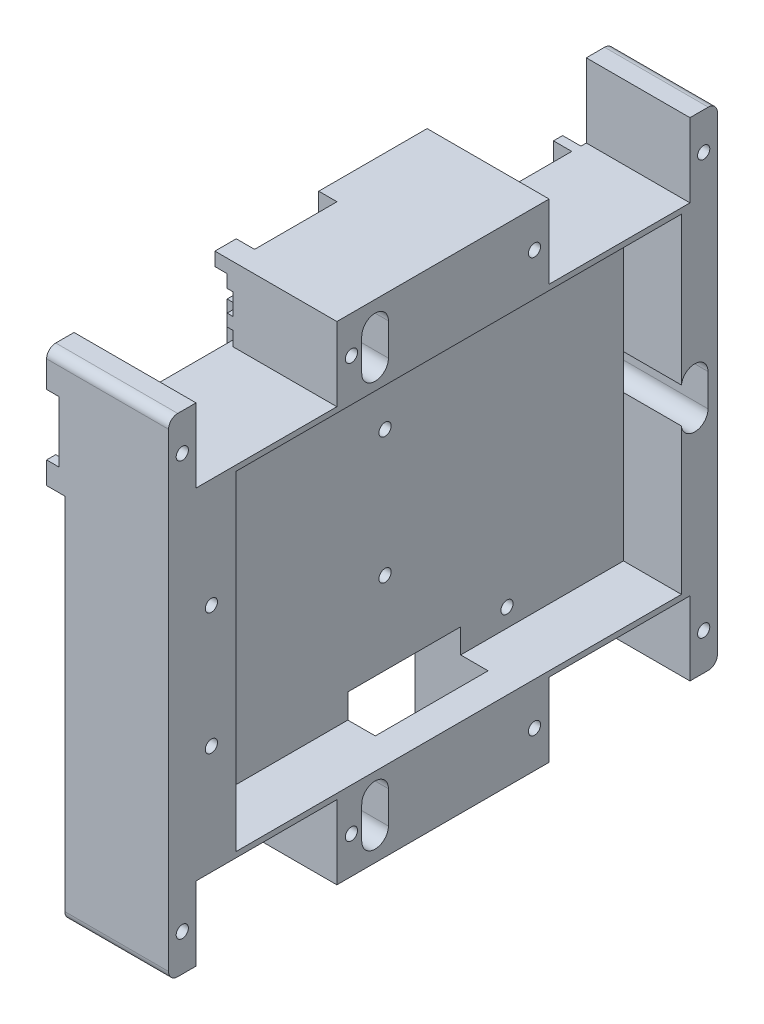
from build123d import *
from build123d.topology import SkipClean

# Parameters (mm, degrees)
SKETCH_1_R          = 1
EXTRUDE_1_DEPTH     = 17
FILLET_1_R          = 1.5
SKETCH_2_W          = 73
SKETCH_2_H          = 54
CUT_EXTRUDE_1_DEPTH = 9.5
CUT_EXTRUDE_2_DEPTH = 63.561969278
SKETCH_5_W          = 1.5
SKETCH_5_H          = 11.7
SKETCH_5_H_2        = 3.65
EXTRUDE_4_DEPTH     = 3
SKETCH_6_W          = 2
SKETCH_6_H          = 2.1
SKETCH_6_W_2        = 28.1
SKETCH_6_H_2        = 2.023191522
SKETCH_6_H_3        = 1.972847365
EXTRUDE_5_DEPTH     = 1
SKETCH_9_W          = 1.5
SKETCH_9_H          = 7.4
EXTRUDE_6_DEPTH     = 3
SKETCH_10_W         = 18.5
SKETCH_10_H         = 17
CUT_EXTRUDE_3_DEPTH = 12


with BuildPart() as part:
    # Эскиз1 → Бобышка-Вытянуть1 (new body)
    with BuildSketch(Plane(origin=(0, 0, 0), x_dir=(0, 0, -1), z_dir=(1, 0, 0))):
        Polygon((0, 40), (-17.4, 40), (-17.4, 27.9), (-40.5, 27.9), (-40.5, 40), (-45, 40), (-45, -40), (-40.5, -40), (-40.5, -27.9), (-17.4, -27.9), (-17.4, -40), (17.4, -40), (17.4, -27.9), (40.5, -27.9), (40.5, -40), (45, -40), (45, 40), (40.5, 40), (40.5, 27.9), (17.4, 27.9), (17.4, 40), align=None)
        with Locations((-42.75, -33.95)):
            Circle(SKETCH_1_R, mode=Mode.SUBTRACT)
        with Locations(Location((-15.009561353, -33.95, 0), (0, 0, 180))):
            Circle(SKETCH_1_R, mode=Mode.SUBTRACT)
        with Locations((15.009561353, -33.95)):
            Circle(SKETCH_1_R, mode=Mode.SUBTRACT)
        with Locations(Location((42.75, -33.95, 0), (0, 0, 180))):
            Circle(SKETCH_1_R, mode=Mode.SUBTRACT)
        with Locations((42.75, 33.95)):
            Circle(SKETCH_1_R, mode=Mode.SUBTRACT)
        with Locations(Location((15.009561353, 33.95, 0), (0, 0, 180))):
            Circle(SKETCH_1_R, mode=Mode.SUBTRACT)
        with Locations((-15.009561353, 33.95)):
            Circle(SKETCH_1_R, mode=Mode.SUBTRACT)
        with Locations(Location((-42.75, 33.95, 0), (0, 0, 180))):
            Circle(SKETCH_1_R, mode=Mode.SUBTRACT)
        with Locations((20, 24)):
            Circle(SKETCH_1_R, mode=Mode.SUBTRACT)
        with Locations((20, -24)):
            Circle(SKETCH_1_R, mode=Mode.SUBTRACT)
        with Locations((-30.9, -9)):
            Circle(SKETCH_1_R, mode=Mode.SUBTRACT)
        with Locations((-30.9, 19)):
            Circle(SKETCH_1_R, mode=Mode.SUBTRACT)
        with Locations((-37.974473267, -10)):
            Circle(SKETCH_1_R, mode=Mode.SUBTRACT)
        with Locations(Location((-37.974473267, 10, 0), (0, 0, 180))):
            Circle(SKETCH_1_R, mode=Mode.SUBTRACT)
        with Locations((0, 11.240266093)):
            Circle(SKETCH_1_R, mode=Mode.SUBTRACT)
        with Locations((0, -9.5)):
            Circle(SKETCH_1_R, mode=Mode.SUBTRACT)
    extrude(amount=EXTRUDE_1_DEPTH)

    # Скругление1
    fillet_1_edges = [part.edges().sort_by_distance(p)[0] for p in [
        (8.5, 40, -45),
        (8.5, -40, -45),
        (8.5, -40, 45),
        (8.5, 40, 45),
    ]]
    fillet(fillet_1_edges, radius=FILLET_1_R)

    # Эскиз2 → Вырез-Вытянуть1 (cut)
    with BuildSketch(Plane(origin=(17, 0, 0), x_dir=(0, 0, -1), z_dir=(1, 0, 0))):
        with Locations((2.6, 0)):
            Rectangle(SKETCH_2_W, SKETCH_2_H)
    extrude(amount=-CUT_EXTRUDE_1_DEPTH, mode=Mode.SUBTRACT)

    # Эскиз4 → Вырез-Вытянуть2 (cut, through all)
    with BuildSketch(Plane(origin=(17, 0, 0), x_dir=(0, 0, -1), z_dir=(1, 0, 0))):
        with BuildLine():
            Line((-8.946590779, -30.570730506), (-8.946590779, -35.870730626))
            ThreePointArc((-8.946590779, -35.870730626), (-11.133761444, -38.057901291), (-13.320932109, -35.870730626))
            Line((-13.320932109, -35.870730626), (-13.320628351, -30.607174155))
            ThreePointArc((-13.320628351, -30.607174155), (-11.151983902, -28.383628713), (-8.946590779, -30.570730506))
        make_face()
        with BuildLine():
            Line((43.459281483, 2.472349123), (43.459281483, -2.827658037))
            ThreePointArc((43.459281483, -2.827658037), (41.272110818, -5.014828702), (39.084940152, -2.827658037))
            Line((39.084940152, -2.827658037), (39.085243911, 2.435898433))
            ThreePointArc((39.085243911, 2.435898433), (41.25388484, 4.659443847), (43.459281483, 2.472349123))
        make_face()
        with BuildLine():
            Line((-13.320628351, 30.607174155), (-13.320628351, 35.870730626))
            ThreePointArc((-13.320628351, 35.870730626), (-11.133761444, 38.057597532), (-8.946894538, 35.870730626))
            Line((-8.946894538, 35.870730626), (-8.946590779, 30.570730506))
            ThreePointArc((-8.946590779, 30.570730506), (-11.151983902, 28.383628713), (-13.320628351, 30.607174155))
        make_face()
    extrude(amount=-CUT_EXTRUDE_2_DEPTH, mode=Mode.SUBTRACT)

    # Эскиз5 → Бобышка-Вытянуть4 (add)
    with BuildSketch(Plane.ZY):
        Polygon((15.4, 37.8), (17.4, 37.8), (17.4, 40), (13.9, 40), (13.9, 39.3), (13.9, 35.7), (15.4, 35.7), align=None)
        with BuildLine():
            Line((45, 34.15), (43.729795897, 34.15))
            ThreePointArc((43.729795897, 34.15), (43.645142267, 34.395780575), (43.5, 34.611437828))
            Line((43.5, 34.611437828), (43.5, 37.8))
            Line((43.5, 37.8), (40.5, 37.8))
            Line((40.5, 37.8), (40.5, 39.3))
            Line((40.5, 39.3), (40.5, 40))
            Line((40.5, 40), (43.5, 40))
            ThreePointArc((43.5, 40), (44.560660172, 39.560660172), (45, 38.5))
            Line((45, 38.5), (45, 34.15))
        make_face()
        with Locations((14.65, 26.35)):
            Rectangle(SKETCH_5_W, SKETCH_5_H)
        with Locations((44.25, 22.325)):
            Rectangle(SKETCH_5_W, SKETCH_5_H_2)
    extrude(amount=EXTRUDE_4_DEPTH)

    # Эскиз6 → Бобышка-Вытянуть5 (add)
    with SkipClean():  # the faces are left unmerged after this step: merging them gives an invalid solid
        with BuildSketch(Plane.ZY):
            with Locations((16.4, 36.75)):
                Rectangle(SKETCH_6_W, SKETCH_6_H)
            with Locations((29.45, 21.511595761)):
                Rectangle(SKETCH_6_W_2, SKETCH_6_H_2)
            with BuildLine():
                Line((45, 27.9), (45, 24.15))
                Line((45, 24.15), (43.5, 24.15))
                Line((43.5, 24.15), (43.5, 25.77554016))
                Line((43.5, 25.77554016), (43.5, 33.288562172))
                ThreePointArc((43.5, 33.288562172), (43.716212836, 33.692254475), (43.729795897, 34.15))
                Line((43.729795897, 34.15), (45, 34.15))
                Line((45, 34.15), (45, 27.9))
            make_face()
            with BuildLine():
                Line((15.4, 25.77554016), (15.4, 27.9))
                Line((15.4, 27.9), (40.5, 27.9))
                Line((40.5, 27.9), (40.5, 34.15))
                Line((40.5, 34.15), (41.770204103, 34.15))
                ThreePointArc((41.770204103, 34.15), (41.75, 33.95), (41.770204103, 33.75))
                Line((41.770204103, 33.75), (41.770204103, 25.77554016))
                Line((41.770204103, 25.77554016), (15.4, 25.77554016))
            make_face()
            with Locations((16.4, 31.213576318)):
                Rectangle(SKETCH_6_W, SKETCH_6_H_3)
        extrude(amount=EXTRUDE_5_DEPTH)

    # Эскиз9 → Бобышка-Вытянуть6 (add)
    with SkipClean():  # the faces are left unmerged after this step: merging them gives an invalid solid
        with BuildSketch(Plane.ZY):
            Polygon((0.379379219, 37.5), (0.379379219, 20.5), (-1.120620781, 20.5), (-1.120620781, 37.5), (-17.4, 37.5), (-17.4, 40), (0.379379219, 40), align=None)
            with Locations((-38.870620781, 24.2)):
                Rectangle(SKETCH_9_W, SKETCH_9_H)
        extrude(amount=EXTRUDE_6_DEPTH)

    # Эскиз10 → Вырез-Вытянуть3 (cut)
    with SkipClean():  # the faces are left unmerged after this step: merging them gives an invalid solid
        with BuildSketch(Plane.ZY):
            with Locations((-3.15, -31.5)):
                Rectangle(SKETCH_10_W, SKETCH_10_H)
        extrude(amount=-CUT_EXTRUDE_3_DEPTH, mode=Mode.SUBTRACT)


solid = part.part
